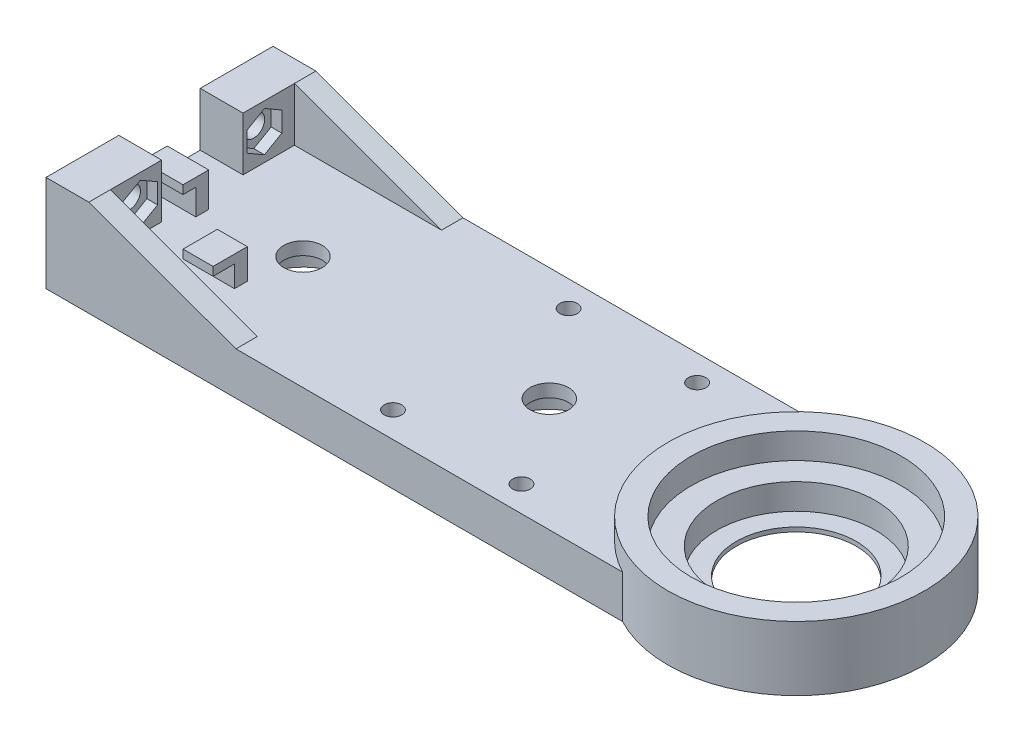
from build123d import *

# Parameters (mm, degrees)
BOSS_EXTRUDE1_DEPTH      = 10
SKETCH3_W                = 10
SKETCH3_H                = 17
BOSS_EXTRUDE2_DEPTH      = 12.5
RIB1_REACH               = 118.391
SKETCH4_WALL_W           = 271.329674284
SKETCH4_WALL_H           = 5
CUT_EXTRUDE1_REACH       = 170.771
SKETCH6_R                = 2.55
CUT_EXTRUDE2_DEPTH       = 2.5
BOSS_EXTRUDE4_DEPTH      = 5
BOSS_EXTRUDE4_DEPTH_BACK = 10
SKETCH11_R               = 30
CUT_EXTRUDE3_REACH       = 111.582
SKETCH8_R                = 14
CUT_EXTRUDE4_DEPTH       = 6
CUT_EXTRUDE4_DEPTH_BACK  = 7
SKETCH9_R                = 18.5
SKETCH12_R               = 24.5
CUT_EXTRUDE6_DEPTH       = 6
SKETCH13_R               = 2.05
CUT_EXTRUDE7_DEPTH       = 110.581884276
CUT_EXTRUDE9_START       = -2
SKETCH15_R               = 24.5
CUT_EXTRUDE9_DEPTH       = 2
SKETCH17_R               = 11.1
CUT_EXTRUDE11_DEPTH      = 7
CUT_EXTRUDE12_REACH      = 111.964
SKETCH18_R               = 4.5
SKETCH19_R               = 11.1
CUT_EXTRUDE13_DEPTH      = 7
CUT_EXTRUDE14_REACH      = 111.964
SKETCH20_R               = 4.5
SKETCH21_W               = 7
SKETCH21_H               = 3
BOSS_EXTRUDE5_DEPTH      = 7
SKETCH22_W               = 7
SKETCH22_H               = 2
BOSS_EXTRUDE6_DEPTH      = 5
SKETCH23_W               = 9.67527482
SKETCH23_H               = 3
BOSS_EXTRUDE7_DEPTH      = 8
SKETCH24_W               = 9.67527482
SKETCH24_H               = 2
BOSS_EXTRUDE8_DEPTH      = 3


with BuildPart() as part:
    # Sketch2 → Boss-Extrude1 (new body)
    with BuildSketch(Plane(origin=(0, 0, 0), x_dir=(1, 0, 0), z_dir=(0, 1, 0))):
        with BuildLine():
            Line((-74, 26.5), (74.6515139, 26.5))
            ThreePointArc((74.6515139, 26.5), (101.1515139, 0), (74.6515139, -26.5))
            Line((74.6515139, -26.5), (-74, -26.5))
            Line((-74, -26.5), (-74, 26.5))
        make_face()
    extrude(amount=BOSS_EXTRUDE1_DEPTH)

    # Sketch3 → Boss-Extrude2 (add)
    with BuildSketch(Plane(origin=(0, 10, 0), x_dir=(1, 0, 0), z_dir=(0, 1, 0))):
        with Locations((-69, -18)):
            Rectangle(SKETCH3_W, SKETCH3_H)
        with Locations((-69, 18)):
            Rectangle(SKETCH3_W, SKETCH3_H)
    extrude(amount=BOSS_EXTRUDE2_DEPTH)

    # Sketch4 wall → Rib1 (add, up to next)
    with BuildSketch(Plane(origin=(-46.828266128, 16.25, 26.5), x_dir=(0.939692620785, -0.342020143327, 0), z_dir=(0.342020143327, 0.939692620785, 0)), mode=Mode.PRIVATE) as rib1_sk1:
        with Locations((0, 2.5)):
            Rectangle(SKETCH4_WALL_W, SKETCH4_WALL_H)
    rib1_tool1 = extrude(rib1_sk1.sketch, amount=-RIB1_REACH, mode=Mode.PRIVATE) - part.part
    rib1 = rib1_tool1.solids().sort_by_distance((-46.828266128, 16.25, 26.5))[0]
    add(rib1)

    # Mirror1: Rib1 across plane
    add(rib1.mirror(Plane.XY))

    # Sketch6 → Cut-Extrude1 (cut, up to next)
    with BuildSketch(Plane(origin=(-64, 0, 0), x_dir=(0, 0, -1), z_dir=(1, 0, 0)), mode=Mode.PRIVATE) as cut_extrude1_sk1:
        with Locations((-14.5, 16.25)):
            Circle(SKETCH6_R)
    cut_extrude1_tool1 = extrude(cut_extrude1_sk1.sketch, amount=-CUT_EXTRUDE1_REACH, mode=Mode.PRIVATE) & part.part
    cut_extrude1 = cut_extrude1_tool1.solids().sort_by_distance((-64, 16.25, 14.5))[0]
    add(cut_extrude1, mode=Mode.SUBTRACT)

    # Sketch7 → Cut-Extrude2 (cut)
    with BuildSketch(Plane(origin=(-64, 0, 0), x_dir=(0, 0, -1), z_dir=(1, 0, 0))):
        Polygon((-10.45, 13.91173141), (-10.45, 18.58826859), (-14.5, 20.92653718), (-18.55, 18.58826859), (-18.55, 13.91173141), (-14.5, 11.57346282), align=None)
    cut_extrude2 = extrude(amount=-CUT_EXTRUDE2_DEPTH, mode=Mode.SUBTRACT)

    # Mirror2: Cut-Extrude1, Cut-Extrude2 across plane
    add(cut_extrude1.mirror(Plane.XY), mode=Mode.SUBTRACT)
    add(cut_extrude2.mirror(Plane.XY), mode=Mode.SUBTRACT)

    # Sketch11 → Boss-Extrude4 (add, two sides: drawn at the far end of the back side and taken through both)
    with BuildSketch(Plane(origin=(0, 10, 0), x_dir=(1, 0, 0), z_dir=(0, 1, 0)).offset(-BOSS_EXTRUDE4_DEPTH_BACK)):
        with Locations(Location((74.6515139, 0, 0), (0, 0, 270))):
            Circle(SKETCH11_R)
    extrude(amount=BOSS_EXTRUDE4_DEPTH + BOSS_EXTRUDE4_DEPTH_BACK)

    # Sketch8 → Cut-Extrude3 (cut, up to next)
    with BuildSketch(Plane(origin=(0, 10, 0), x_dir=(1, 0, 0), z_dir=(0, 1, 0)), mode=Mode.PRIVATE) as cut_extrude3_sk1:
        with Locations(Location((74.6515139, 0, 0), (0, 0, 270))):
            Circle(SKETCH8_R)
    cut_extrude3_tool1 = extrude(cut_extrude3_sk1.sketch, amount=-CUT_EXTRUDE3_REACH, mode=Mode.PRIVATE) & part.part
    add(cut_extrude3_tool1.solids().sort_by_distance((74.651514, 10, 0))[0], mode=Mode.SUBTRACT)

    # Sketch9 → Cut-Extrude4 (cut, two sides: drawn at the far end of the back side and taken through both)
    with BuildSketch(Plane(origin=(0, 10, 0), x_dir=(1, 0, 0), z_dir=(0, 1, 0)).offset(-CUT_EXTRUDE4_DEPTH_BACK)):
        with Locations(Location((74.6515139, 0, 0), (0, 0, 270))):
            Circle(SKETCH9_R)
    extrude(amount=CUT_EXTRUDE4_DEPTH + CUT_EXTRUDE4_DEPTH_BACK, mode=Mode.SUBTRACT)

    # Sketch12 → Cut-Extrude6 (cut)
    with BuildSketch(Plane(origin=(0, 15, 0), x_dir=(1, 0, 0), z_dir=(0, 1, 0))):
        with Locations(Location((74.6515139, 0, 0), (0, 0, 270))):
            Circle(SKETCH12_R)
    extrude(amount=-CUT_EXTRUDE6_DEPTH, mode=Mode.SUBTRACT)

    # Sketch13 → Cut-Extrude7 (cut, through all)
    with BuildSketch(Plane(origin=(0, 10, 0), x_dir=(1, 0, 0), z_dir=(0, 1, 0))):
        with Locations(Location((1, -20.5, 0), (0, 0, 270))):
            Circle(SKETCH13_R)
        with Locations(Location((31, -20.5, 0), (0, 0, 270))):
            Circle(SKETCH13_R)
    cut_extrude7 = extrude(amount=-CUT_EXTRUDE7_DEPTH, mode=Mode.SUBTRACT)

    # Sketch15 → Cut-Extrude9 (cut)
    with BuildSketch(Plane.XZ.offset(CUT_EXTRUDE9_START)):
        with Locations(Location((74.6515139, 0, 0), (0, 0, 90))):
            Circle(SKETCH15_R)
    extrude(amount=CUT_EXTRUDE9_DEPTH, mode=Mode.SUBTRACT)

    # Sketch17 → Cut-Extrude11 (cut)
    with BuildSketch(Plane.XZ):
        with Locations(Location((-40.5, 0, 0), (0, 0, 270))):
            Circle(SKETCH17_R)
    extrude(amount=-CUT_EXTRUDE11_DEPTH, mode=Mode.SUBTRACT)

    # Sketch18 → Cut-Extrude12 (cut, up to next)
    with BuildSketch(Plane.XZ.offset(-7), mode=Mode.PRIVATE) as cut_extrude12_sk1:
        with Locations(Location((-40.5, 0, 0), (0, 0, 270))):
            Circle(SKETCH18_R)
    cut_extrude12_tool1 = extrude(cut_extrude12_sk1.sketch, amount=-CUT_EXTRUDE12_REACH, mode=Mode.PRIVATE) & part.part
    add(cut_extrude12_tool1.solids().sort_by_distance((-40.5, 7, 0))[0], mode=Mode.SUBTRACT)

    # Sketch19 → Cut-Extrude13 (cut)
    with BuildSketch(Plane.XZ):
        with Locations(Location((17, 0, 0), (0, 0, 270))):
            Circle(SKETCH19_R)
    extrude(amount=-CUT_EXTRUDE13_DEPTH, mode=Mode.SUBTRACT)

    # Sketch20 → Cut-Extrude14 (cut, up to next)
    with BuildSketch(Plane.XZ.offset(-7), mode=Mode.PRIVATE) as cut_extrude14_sk1:
        with Locations(Location((17, 0, 0), (0, 0, 270))):
            Circle(SKETCH20_R)
    cut_extrude14_tool1 = extrude(cut_extrude14_sk1.sketch, amount=-CUT_EXTRUDE14_REACH, mode=Mode.PRIVATE) & part.part
    add(cut_extrude14_tool1.solids().sort_by_distance((17, 7, 0))[0], mode=Mode.SUBTRACT)

    # Mirror3: Cut-Extrude7 across plane
    add(cut_extrude7.mirror(Plane.XY), mode=Mode.SUBTRACT)

    # Sketch21 → Boss-Extrude5 (add)
    with BuildSketch(Plane(origin=(0, 10, 0), x_dir=(1, 0, 0), z_dir=(0, 1, 0))):
        with Locations((-45.5, -13)):
            Rectangle(SKETCH21_W, SKETCH21_H)
    extrude(amount=BOSS_EXTRUDE5_DEPTH)

    # Sketch22 → Boss-Extrude6 (add)
    with BuildSketch(Plane.XY.offset(14.5)):
        with Locations((-45.5, 16)):
            Rectangle(SKETCH22_W, SKETCH22_H)
    extrude(amount=BOSS_EXTRUDE6_DEPTH)

    # Sketch23 → Boss-Extrude7 (add)
    with BuildSketch(Plane(origin=(0, 10, 0), x_dir=(1, 0, 0), z_dir=(0, 1, 0))):
        with Locations((-65.857730682, -3)):
            Rectangle(SKETCH23_W, SKETCH23_H)
    extrude(amount=BOSS_EXTRUDE7_DEPTH)

    # Sketch24 → Boss-Extrude8 (add)
    with BuildSketch(Plane.XY.offset(4.5)):
        with Locations((-65.857730682, 17)):
            Rectangle(SKETCH24_W, SKETCH24_H)
    extrude(amount=BOSS_EXTRUDE8_DEPTH)


solid = part.part
